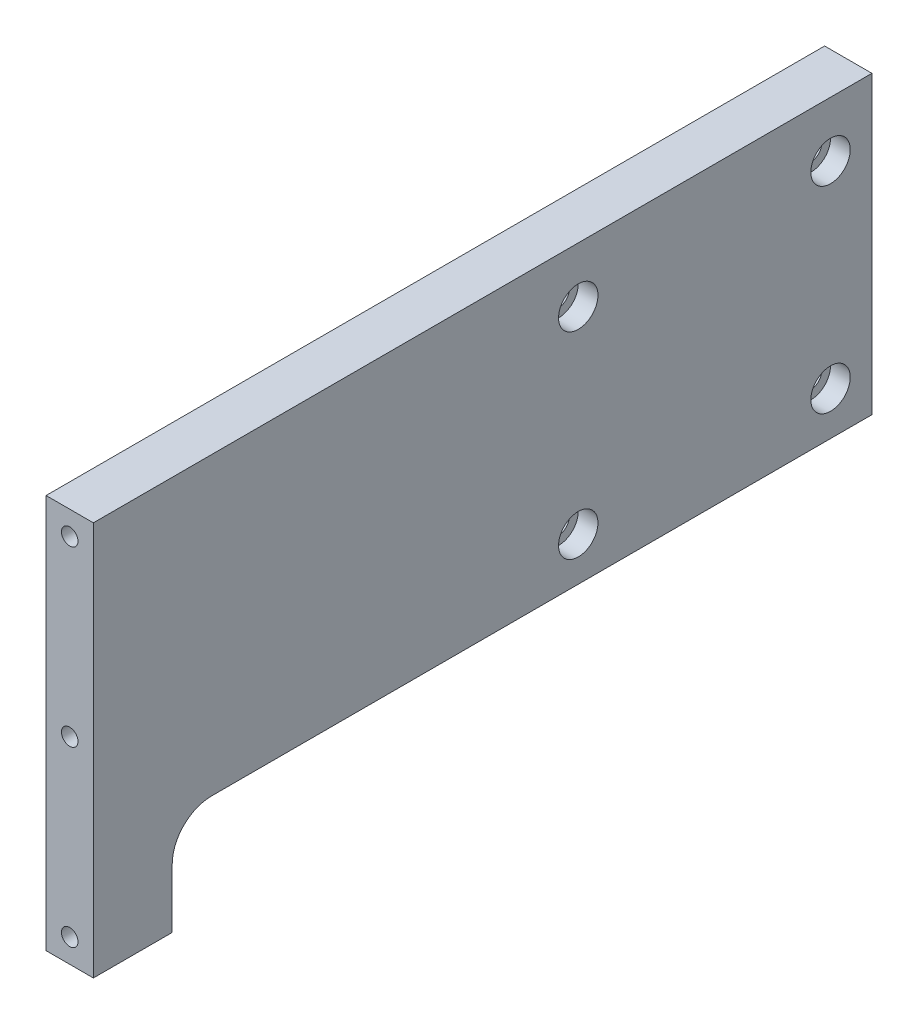
from build123d import *

# Parameters (mm, degrees)
BOSS_EXTRUDE1_DEPTH                             = 12
FILLET1_R                                       = 10
M5X0_8_TAPPED_HOLE1_D                           = 4.2
M5X0_8_TAPPED_HOLE1_DEPTH                       = 14
M5X0_8_TAPPED_HOLE1_TIP                         = 1.2618073
CBORE_FOR_M5_SOCKET_HEAD_CAP_SCREW1_D           = 5.5
CBORE_FOR_M5_SOCKET_HEAD_CAP_SCREW1_CBORE_D     = 10
CBORE_FOR_M5_SOCKET_HEAD_CAP_SCREW1_CBORE_DEPTH = 5


with BuildPart() as part:
    # Sketch1 → Boss-Extrude1 (new body)
    with BuildSketch(Plane(origin=(0, 0, 0), x_dir=(0, 0, -1), z_dir=(1, 0, 0))):
        Polygon((0, 0), (197.5, 0), (197.5, -75), (20, -75), (20, -100), (0, -100), align=None)
    extrude(amount=BOSS_EXTRUDE1_DEPTH)

    # Fillet1
    fillet1_edges = [part.edges().sort_by_distance(p)[0] for p in [
        (6, -75, -20),
    ]]
    fillet(fillet1_edges, radius=FILLET1_R)

    # M5x0.8 Tapped Hole1
    with Locations(Plane.XY):
        with Locations((6, -6), (6, -50), (6, -94)):
            Hole(M5X0_8_TAPPED_HOLE1_D / 2, depth=M5X0_8_TAPPED_HOLE1_DEPTH)
            with Locations((0, 0, -(M5X0_8_TAPPED_HOLE1_DEPTH + M5X0_8_TAPPED_HOLE1_TIP / 2))):  # 118° drill point
                Cone(0, M5X0_8_TAPPED_HOLE1_D / 2, M5X0_8_TAPPED_HOLE1_TIP, mode=Mode.SUBTRACT)

    # CBORE for M5 Socket Head Cap Screw1 (through all)
    with Locations(Plane(origin=(12, 0, 0), x_dir=(0, 0, -1), z_dir=(1, 0, 0))):
        with Locations((123, -14), (123, -64), (187, -64), (187, -14)):
            CounterBoreHole(CBORE_FOR_M5_SOCKET_HEAD_CAP_SCREW1_D / 2, CBORE_FOR_M5_SOCKET_HEAD_CAP_SCREW1_CBORE_D / 2, CBORE_FOR_M5_SOCKET_HEAD_CAP_SCREW1_CBORE_DEPTH)


solid = part.part
